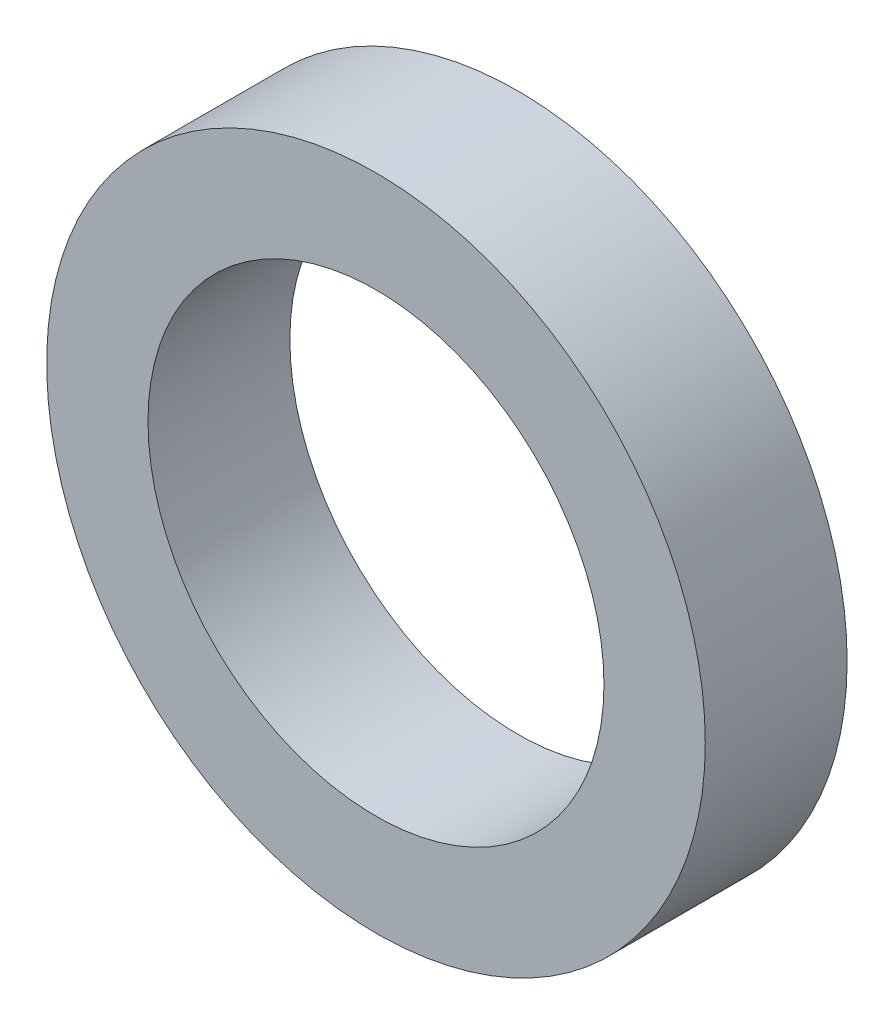
from build123d import *

# Parameters (mm, degrees)
SKETCH_1_R      = 32.5
SKETCH_1_R_2    = 22.5
EXTRUDE_1_DEPTH = 14


with BuildPart() as part:
    # 草图1 → 凸台-拉伸1 (new body)
    with BuildSketch(Plane.XY):
        Circle(SKETCH_1_R)
        Circle(SKETCH_1_R_2, mode=Mode.SUBTRACT)
    extrude(amount=EXTRUDE_1_DEPTH)


solid = part.part
